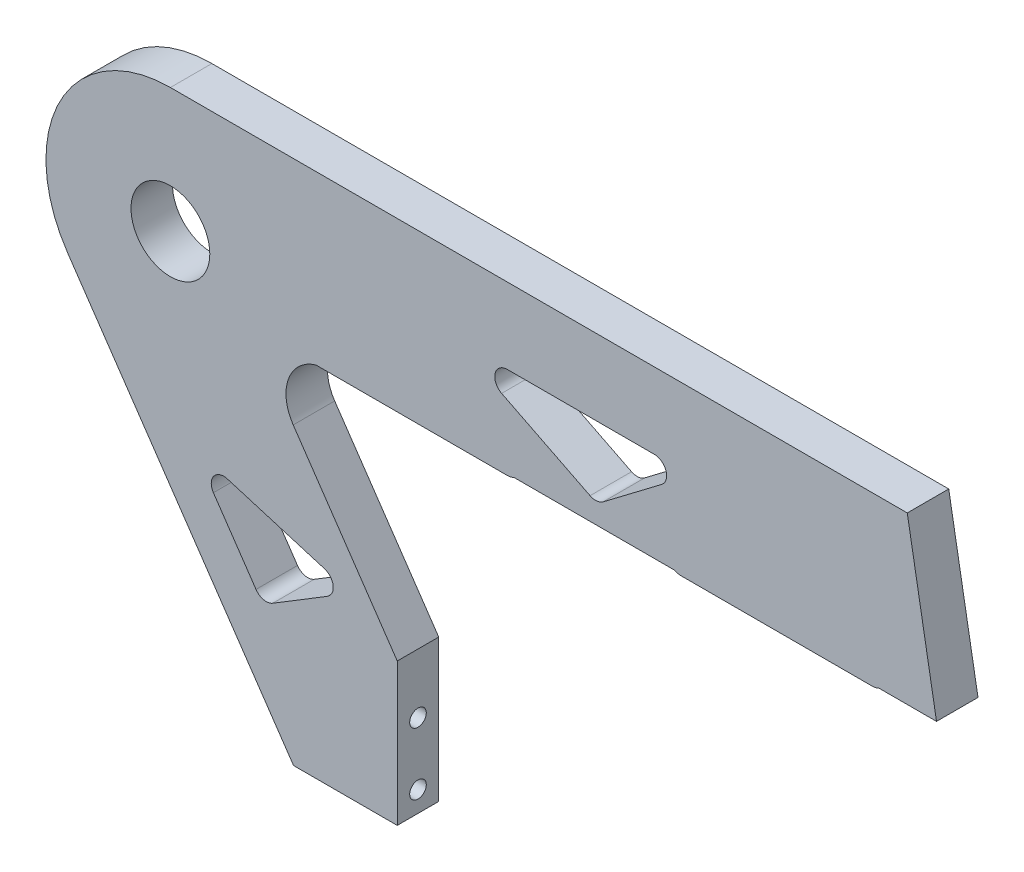
from build123d import *

# Parameters (mm, degrees)
SKETCH1_R           = 9.5
BOSS_EXTRUDE2_DEPTH = 5
SKETCH2_R           = 2
CUT_EXTRUDE1_DEPTH  = 43.5


with BuildPart() as part:
    # Sketch1 → Boss-Extrude2 (new, symmetric)
    with BuildSketch(Plane.XY):
        with BuildLine():
            Line((-25, 0), (0, 0))
            Line((0, 0), (0, 34.32666264))
            Line((0, 34.32666264), (-25.081844034, 71.075487971))
            ThreePointArc((-25.081844034, 71.075487971), (-26.228666022, 80.106897872), (-19.579322507, 86.325241404))
            Line((-19.579322507, 86.325241404), (26.604717255, 86.325241404))
            ThreePointArc((26.604717255, 86.325241404), (27.367190328, 86.423753026), (28.079588429, 86.712818196))
            Line((28.079588429, 86.712818196), (66.87872037, 86.712818196))
            ThreePointArc((66.87872037, 86.712818196), (67.591118471, 86.423753026), (68.353591544, 86.325241404))
            Line((68.353591544, 86.325241404), (114.623497212, 86.325241404))
            ThreePointArc((114.623497212, 86.325241404), (115.385970286, 86.423753026), (116.098368387, 86.712818196))
            Line((116.098368387, 86.712818196), (130, 86.712818196))
            Line((130, 86.712818196), (122.946920772, 126.712818196))
            Line((122.946920772, 126.712818196), (-54.687026413, 126.712818196))
            ThreePointArc((-54.687026413, 126.712818196), (-81.213991187, 110.724247098), (-79.465738474, 79.800827522))
            Line((-79.465738474, 79.800827522), (-25, 0))
        make_face()
        with BuildLine():
            Line((-34.048206361, 32.250592263), (-44.320136127, 47.300576318))
            ThreePointArc((-44.320136127, 47.300576318), (-44.262816837, 50.76404185), (-40.978396488, 51.864706177))
            Line((-40.978396488, 51.864706177), (-17.56266475, 44.823773781))
            ThreePointArc((-17.56266475, 44.823773781), (-15.450916476, 42.332556513), (-16.865487004, 39.388981395))
            Line((-16.865487004, 39.388981395), (-30.009288975, 31.379929737))
            ThreePointArc((-30.009288975, 31.379929737), (-32.202518151, 31.009156908), (-34.048206361, 32.250592263))
        make_face(mode=Mode.SUBTRACT)
        with Locations((-54.687026413, 96.712818196)):
            Circle(SKETCH1_R, mode=Mode.SUBTRACT)
        with BuildLine():
            ThreePointArc((25.16023195, 102.779114733), (23.586428727, 106.151820228), (26.505685136, 108.460486719))
            Line((26.505685136, 108.460486719), (61.945496305, 108.460486719))
            ThreePointArc((61.945496305, 108.460486719), (64.78922159, 106.416115571), (63.757193592, 103.069304387))
            Line((63.757193592, 103.069304387), (49.637443167, 92.371369228))
            ThreePointArc((49.637443167, 92.371369228), (48.10033357, 91.775144389), (46.480292695, 92.081179573))
            Line((46.480292695, 92.081179573), (25.16023195, 102.779114733))
        make_face(mode=Mode.SUBTRACT)
    extrude(amount=BOSS_EXTRUDE2_DEPTH, both=True)

    # Sketch2 → Cut-Extrude1 (cut, symmetric)
    with BuildSketch(Plane(origin=(0, 0, 0), x_dir=(0, 0, -1), z_dir=(1, 0, 0))):
        with Locations(Location((0, 5, 0), (0, 0, 90))):
            Circle(SKETCH2_R)
        with Locations(Location((0, 20, 0), (0, 0, 90))):
            Circle(SKETCH2_R)
    extrude(amount=CUT_EXTRUDE1_DEPTH, both=True, mode=Mode.SUBTRACT)


solid = part.part
